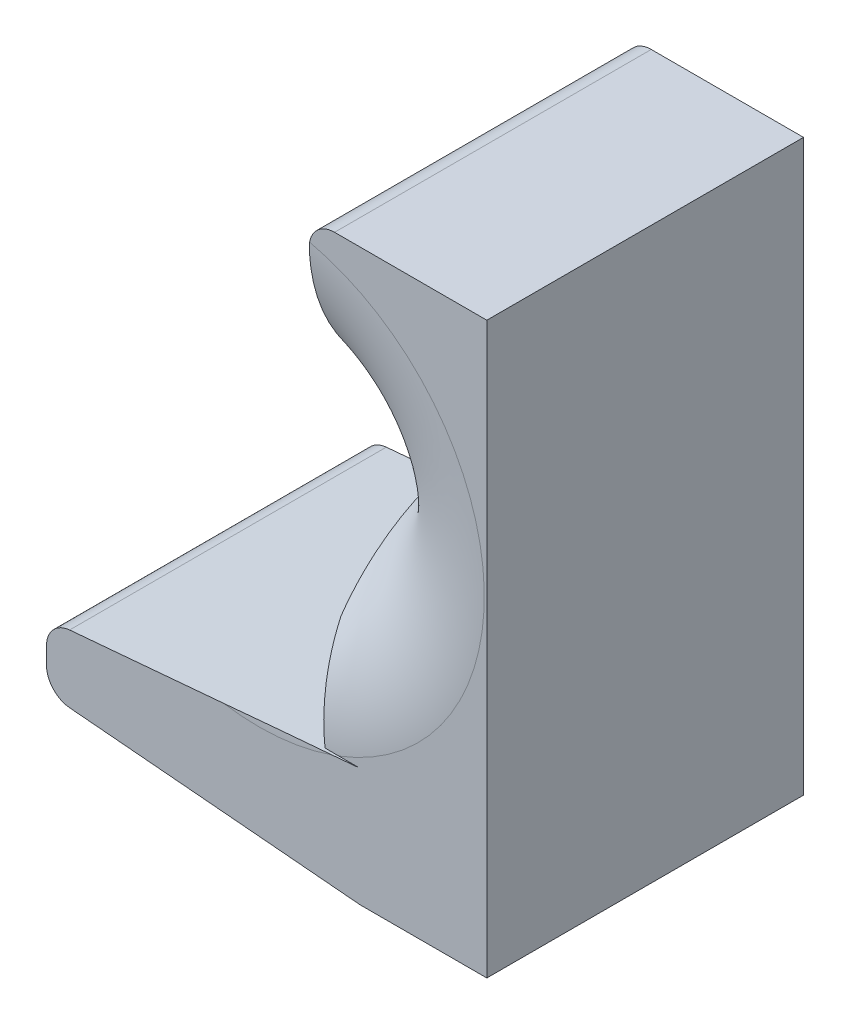
from build123d import *

# Parameters (mm, degrees)
BOSS_EXTRUDE1_DEPTH = 12.5
BOSS_EXTRUDE2_DEPTH = 4.02005
FILLET2_R           = 2


with BuildPart() as part:
    # Sketch2 → Boss-Extrude1 (new, symmetric)
    with BuildSketch(Plane.XY):
        Polygon((29.367996497, -11.749519802), (29.367996497, -35.249519802), (33.388046748, -35.249519802), (33.388046748, -47.391114069), (8.625661213, -49.557542086), (8.625661213, -54.557542086), (33.388046748, -56.723970102), (43.388046748, -56.723970102), (43.388046748, -11.749519802), align=None)
    extrude(amount=BOSS_EXTRUDE1_DEPTH, both=True)

    # Sketch4 → Boss-Extrude2 (add)
    with BuildSketch(Plane.ZY.offset(-33.388046748)):
        with BuildLine():
            Line((-12.5, -35.249519802), (-12.5, -47.391114069))
            Line((-12.5, -47.391114069), (-12.494860757, -47.391114069))
            ThreePointArc((-12.494860757, -47.391114069), (-8.711197631, -38.784864994), (0, -35.249519802))
            Line((0, -35.249519802), (-12.5, -35.249519802))
        make_face()
        with BuildLine():
            Line((12.5, -35.249519802), (0, -35.249519802))
            ThreePointArc((0, -35.249519802), (8.711197631, -38.784864994), (12.494860757, -47.391114069))
            Line((12.494860757, -47.391114069), (12.5, -47.391114069))
            Line((12.5, -47.391114069), (12.5, -35.249519802))
        make_face()
    extrude(amount=BOSS_EXTRUDE2_DEPTH)

    # Sketch3 → Cut-Revolve1 (revolve, cut)
    with BuildSketch(Plane.ZY.offset(-25.388046748)):
        with BuildLine():
            Line((-12.5, -30.749519802), (12.5, -30.749519802))
            Line((12.5, -30.749519802), (12.5, -12.949519802))
            ThreePointArc((12.5, -12.949519802), (0, -25.449519802), (-12.5, -12.949519802))
            Line((-12.5, -12.949519802), (-12.5, -30.749519802))
        make_face()
    revolve(axis=Axis((25.388046748, -30.749519802, -12.5), (0, 0, 1)), mode=Mode.SUBTRACT)

    # Fillet2
    fillet2_edges = [part.edges().sort_by_distance(p)[0] for p in [
        (29.367996497, -11.749519802, 0),
        (8.625661213, -49.557542086, 0),
        (8.625661213, -54.557542086, 0),
    ]]
    fillet(fillet2_edges, radius=FILLET2_R)


solid = part.part
